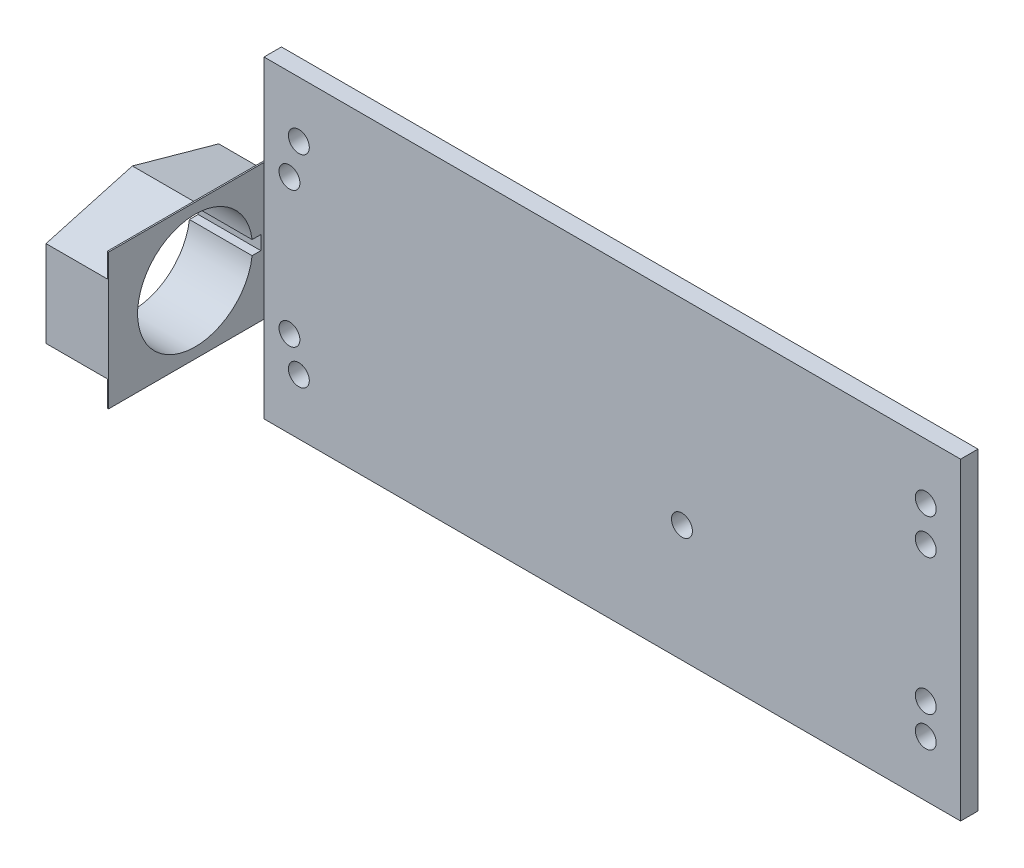
from build123d import *

# Parameters (mm, degrees)
SKETCH1_W               = 100
SKETCH1_H               = 45
SKETCH1_R               = 1.5
BOSS_EXTRUDE2_DEPTH     = 2.5
CUT_EXTRUDE2_DEPTH      = 13
CUT_EXTRUDE2_DEPTH_BACK = 17
SKETCH2_R               = 1.5
SKETCH3_W               = 9
SKETCH3_H               = 19.5
BOSS_EXTRUDE3_DEPTH     = 24.8
CUT_EXTRUDE3_DEPTH      = 8.8
SKETCH7_R               = 8.25
CUT_EXTRUDE4_DEPTH      = 714.8
SKETCH8_W               = 1.252352654
SKETCH8_H               = 2
CUT_EXTRUDE5_DEPTH      = 714.8


with BuildPart() as part:
    # Sketch1 → Boss-Extrude2 (new body)
    with BuildSketch(Plane.XY):
        with Locations((-446.059405941, 217.618811881)):
            Rectangle(SKETCH1_W, SKETCH1_H)
        with Locations((-491.059405941, 232.118811881)):
            Circle(SKETCH1_R, mode=Mode.SUBTRACT)
        with Locations((-491.059405941, 203.118811881)):
            Circle(SKETCH1_R, mode=Mode.SUBTRACT)
        with Locations(Location((-401.059405941, 203.118811881, 0), (0, 0, 180))):
            Circle(SKETCH1_R, mode=Mode.SUBTRACT)
        with Locations(Location((-401.059405941, 232.118811881, 0), (0, 0, 180))):
            Circle(SKETCH1_R, mode=Mode.SUBTRACT)
    extrude(amount=BOSS_EXTRUDE2_DEPTH)

    # Sketch2 → Cut-Extrude2 (cut, two sides: drawn at the far end of the back side and taken through both)
    with BuildSketch(Plane.XY.offset(2.5).offset(-CUT_EXTRUDE2_DEPTH_BACK)):
        with Locations((-436.059405941, 211.918811881)):
            Circle(SKETCH2_R)
        with Locations((-401.059405941, 227.018811881)):
            Circle(SKETCH2_R)
        with Locations((-401.059405941, 207.518811881)):
            Circle(SKETCH2_R)
        with Locations((-492.409405941, 207.518811881)):
            Circle(SKETCH2_R)
        with Locations((-492.409405941, 227.018811881)):
            Circle(SKETCH2_R)
    extrude(amount=CUT_EXTRUDE2_DEPTH + CUT_EXTRUDE2_DEPTH_BACK, mode=Mode.SUBTRACT)

    # Sketch3 → Boss-Extrude3 (add)
    with BuildSketch(Plane.XY):
        with Locations((-500.559405941, 217.268811881)):
            Rectangle(SKETCH3_W, SKETCH3_H)
    extrude(amount=BOSS_EXTRUDE3_DEPTH)

    # Sketch4 → Cut-Extrude3 (cut)
    with BuildSketch(Plane.ZY.offset(505.059405941)):
        Polygon((0, 225.268811881), (0, 223.569543899), (12.4, 227.018811881), (0, 227.018811881), align=None)
        Polygon((24.8, 227.018811881), (12.4, 227.018811881), (24.8, 223.569543899), align=None)
        Polygon((24.8, 211.150624905), (12.4, 207.518811881), (24.8, 207.518811881), align=None)
        Polygon((12.4, 207.518811881), (0, 211.150624905), (0, 209.268811881), (0, 207.518811881), align=None)
    extrude(amount=-CUT_EXTRUDE3_DEPTH, mode=Mode.SUBTRACT)

    # Sketch7 → Cut-Extrude4 (cut)
    with BuildSketch(Plane(origin=(0, 0, 0), x_dir=(0, 0, -1), z_dir=(1, 0, 0))):
        with Locations((-12.4, 217.268811881)):
            Circle(SKETCH7_R)
    extrude(amount=-CUT_EXTRUDE4_DEPTH, mode=Mode.SUBTRACT)

    # Sketch8 → Cut-Extrude5 (cut)
    with BuildSketch(Plane(origin=(0, 0, 0), x_dir=(0, 0, -1), z_dir=(1, 0, 0))):
        with Locations((-3.584653996, 217.268811881)):
            Rectangle(SKETCH8_W, SKETCH8_H)
    extrude(amount=-CUT_EXTRUDE5_DEPTH, mode=Mode.SUBTRACT)


solid = part.part
